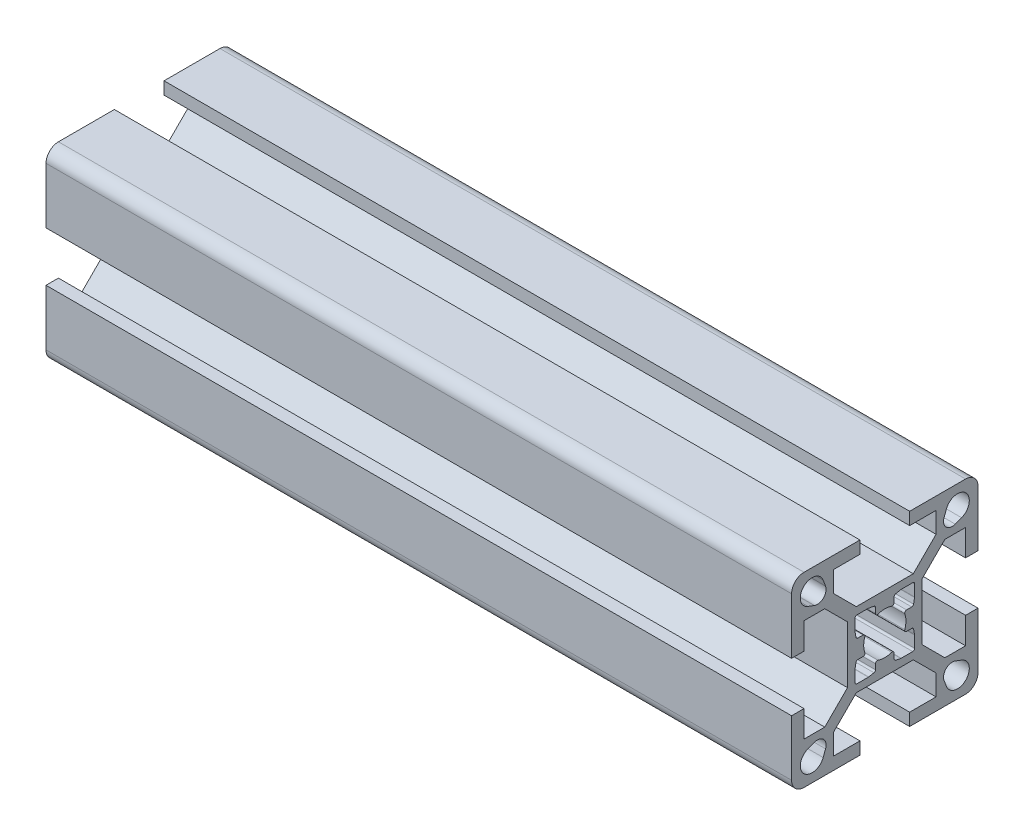
from build123d import *

# Parameters (mm, degrees)
BOSS_EXTRUDE1_DEPTH = 120


with BuildPart() as part:
    # Sketch1 → Boss-Extrude1 (new body)
    with BuildSketch(Plane(origin=(0, 0, 0), x_dir=(0, 0, -1), z_dir=(1, 0, 0))):
        with BuildLine():
            Line((-15, 13), (-15, 4))
            Line((-15, 4), (-13, 4))
            Line((-13, 4), (-13, 8.25))
            Line((-13, 8.25), (-9.664213562, 8.25))
            Line((-9.664213562, 8.25), (-6, 4.585786438))
            Line((-6, 4.585786438), (-6, -4.585786438))
            Line((-6, -4.585786438), (-9.664213562, -8.25))
            Line((-9.664213562, -8.25), (-13, -8.25))
            Line((-13, -8.25), (-13, -4))
            Line((-13, -4), (-15, -4))
            Line((-15, -4), (-15, -13))
            ThreePointArc((-15, -13), (-14.414213562, -14.414213562), (-13, -15))
            Line((-13, -15), (-4, -15))
            Line((-4, -15), (-4, -13))
            Line((-4, -13), (-8.25, -13))
            Line((-8.25, -13), (-8.25, -9.664213562))
            Line((-8.25, -9.664213562), (-4.585786438, -6))
            Line((-4.585786438, -6), (4.585786438, -6))
            Line((4.585786438, -6), (8.25, -9.664213562))
            Line((8.25, -9.664213562), (8.25, -13))
            Line((8.25, -13), (4, -13))
            Line((4, -13), (4, -15))
            Line((4, -15), (13, -15))
            ThreePointArc((13, -15), (14.414213562, -14.414213562), (15, -13))
            Line((15, -13), (15, -4))
            Line((15, -4), (13, -4))
            Line((13, -4), (13, -8.25))
            Line((13, -8.25), (9.664213562, -8.25))
            Line((9.664213562, -8.25), (6, -4.585786438))
            Line((6, -4.585786438), (6, 4.585786438))
            Line((6, 4.585786438), (9.664213562, 8.25))
            Line((9.664213562, 8.25), (13, 8.25))
            Line((13, 8.25), (13, 4))
            Line((13, 4), (15, 4))
            Line((15, 4), (15, 13))
            ThreePointArc((15, 13), (14.414213562, 14.414213562), (13, 15))
            Line((13, 15), (4, 15))
            Line((4, 15), (4, 13))
            Line((4, 13), (8.25, 13))
            Line((8.25, 13), (8.25, 9.664213562))
            Line((8.25, 9.664213562), (4.585786438, 6))
            Line((4.585786438, 6), (-4.585786438, 6))
            Line((-4.585786438, 6), (-8.25, 9.664213562))
            Line((-8.25, 9.664213562), (-8.25, 13))
            Line((-8.25, 13), (-4, 13))
            Line((-4, 13), (-4, 15))
            Line((-4, 15), (-13, 15))
            ThreePointArc((-13, 15), (-14.414213562, 14.414213562), (-15, 13))
        make_face()
        with BuildLine():
            Line((-9.539070071, 11.338915743), (-9.918883282, 12.361530981))
            ThreePointArc((-9.918883282, 12.361530981), (-13.043502884, 13.043502884), (-12.361530981, 9.918883282))
            Line((-12.361530981, 9.918883282), (-11.338915743, 9.539070071))
            ThreePointArc((-11.338915743, 9.539070071), (-9.861522369, 9.861522369), (-9.539070071, 11.338915743))
        make_face(mode=Mode.SUBTRACT)
        with BuildLine():
            Line((9.918883282, 12.361530981), (9.539070071, 11.338915743))
            ThreePointArc((9.539070071, 11.338915743), (9.861522369, 9.861522369), (11.338915743, 9.539070071))
            Line((11.338915743, 9.539070071), (12.361530981, 9.918883282))
            ThreePointArc((12.361530981, 9.918883282), (13.043502884, 13.043502884), (9.918883282, 12.361530981))
        make_face(mode=Mode.SUBTRACT)
        with BuildLine():
            Line((12.361530981, -9.918883282), (11.338915743, -9.539070071))
            ThreePointArc((11.338915743, -9.539070071), (9.861522369, -9.861522369), (9.539070071, -11.338915743))
            Line((9.539070071, -11.338915743), (9.918883282, -12.361530981))
            ThreePointArc((9.918883282, -12.361530981), (13.043502884, -13.043502884), (12.361530981, -9.918883282))
        make_face(mode=Mode.SUBTRACT)
        with BuildLine():
            Line((-11.338915743, -9.539070071), (-12.361530981, -9.918883282))
            ThreePointArc((-12.361530981, -9.918883282), (-13.043502884, -13.043502884), (-9.918883282, -12.361530981))
            Line((-9.918883282, -12.361530981), (-9.539070071, -11.338915743))
            ThreePointArc((-9.539070071, -11.338915743), (-9.861522369, -9.861522369), (-11.338915743, -9.539070071))
        make_face(mode=Mode.SUBTRACT)
        with BuildLine():
            Line((-4.8, -2.644433572), (-4.8, -4.5))
            ThreePointArc((-4.8, -4.5), (-4.712132034, -4.712132034), (-4.5, -4.8))
            Line((-4.5, -4.8), (-2.644433572, -4.8))
            ThreePointArc((-2.644433572, -4.8), (-2.615679847, -4.79861886), (-2.587190874, -4.794488155))
            Line((-2.587190874, -4.794488155), (-1.742757301, -4.630346896))
            ThreePointArc((-1.742757301, -4.630346896), (-1.568512625, -4.526682207), (-1.5, -4.335858741))
            Line((-1.5, -4.335858741), (-1.5, -3.5))
            ThreePointArc((-1.5, -3.5), (-1.374371458, -3.255879959), (-1.102702703, -3.216216216))
            ThreePointArc((-1.102702703, -3.216216216), (0, -3.4), (1.102702703, -3.216216216))
            ThreePointArc((1.102702703, -3.216216216), (1.374371458, -3.255879959), (1.5, -3.5))
            Line((1.5, -3.5), (1.5, -4.335858741))
            ThreePointArc((1.5, -4.335858741), (1.568512625, -4.526682207), (1.742757301, -4.630346896))
            Line((1.742757301, -4.630346896), (2.587190874, -4.794488155))
            ThreePointArc((2.587190874, -4.794488155), (2.615679847, -4.79861886), (2.644433572, -4.8))
            Line((2.644433572, -4.8), (4.5, -4.8))
            ThreePointArc((4.5, -4.8), (4.712132034, -4.712132034), (4.8, -4.5))
            Line((4.8, -4.5), (4.8, -2.644433572))
            ThreePointArc((4.8, -2.644433572), (4.79861886, -2.615679847), (4.794488155, -2.587190874))
            Line((4.794488155, -2.587190874), (4.630346896, -1.742757301))
            ThreePointArc((4.630346896, -1.742757301), (4.526682207, -1.568512625), (4.335858741, -1.5))
            Line((4.335858741, -1.5), (3.5, -1.5))
            ThreePointArc((3.5, -1.5), (3.255879959, -1.374371458), (3.216216216, -1.102702703))
            ThreePointArc((3.216216216, -1.102702703), (3.4, 0), (3.216216216, 1.102702703))
            ThreePointArc((3.216216216, 1.102702703), (3.255879959, 1.374371458), (3.5, 1.5))
            Line((3.5, 1.5), (4.335858741, 1.5))
            ThreePointArc((4.335858741, 1.5), (4.526682207, 1.568512625), (4.630346896, 1.742757301))
            Line((4.630346896, 1.742757301), (4.794488155, 2.587190874))
            ThreePointArc((4.794488155, 2.587190874), (4.79861886, 2.615679847), (4.8, 2.644433572))
            Line((4.8, 2.644433572), (4.8, 4.5))
            ThreePointArc((4.8, 4.5), (4.712132034, 4.712132034), (4.5, 4.8))
            Line((4.5, 4.8), (2.644433572, 4.8))
            ThreePointArc((2.644433572, 4.8), (2.615679847, 4.79861886), (2.587190874, 4.794488155))
            Line((2.587190874, 4.794488155), (1.742757301, 4.630346896))
            ThreePointArc((1.742757301, 4.630346896), (1.568512625, 4.526682207), (1.5, 4.335858741))
            Line((1.5, 4.335858741), (1.5, 3.5))
            ThreePointArc((1.5, 3.5), (1.374371458, 3.255879959), (1.102702703, 3.216216216))
            ThreePointArc((1.102702703, 3.216216216), (0, 3.4), (-1.102702703, 3.216216216))
            ThreePointArc((-1.102702703, 3.216216216), (-1.374371458, 3.255879959), (-1.5, 3.5))
            Line((-1.5, 3.5), (-1.5, 4.335858741))
            ThreePointArc((-1.5, 4.335858741), (-1.568512625, 4.526682207), (-1.742757301, 4.630346896))
            Line((-1.742757301, 4.630346896), (-2.587190874, 4.794488155))
            ThreePointArc((-2.587190874, 4.794488155), (-2.615679847, 4.79861886), (-2.644433572, 4.8))
            Line((-2.644433572, 4.8), (-4.5, 4.8))
            ThreePointArc((-4.5, 4.8), (-4.712132034, 4.712132034), (-4.8, 4.5))
            Line((-4.8, 4.5), (-4.8, 2.644433572))
            ThreePointArc((-4.8, 2.644433572), (-4.79861886, 2.615679847), (-4.794488155, 2.587190874))
            Line((-4.794488155, 2.587190874), (-4.630346896, 1.742757301))
            ThreePointArc((-4.630346896, 1.742757301), (-4.526682207, 1.568512625), (-4.335858741, 1.5))
            Line((-4.335858741, 1.5), (-3.5, 1.5))
            ThreePointArc((-3.5, 1.5), (-3.255879959, 1.374371458), (-3.216216216, 1.102702703))
            ThreePointArc((-3.216216216, 1.102702703), (-3.4, 0), (-3.216216216, -1.102702703))
            ThreePointArc((-3.216216216, -1.102702703), (-3.255879959, -1.374371458), (-3.5, -1.5))
            Line((-3.5, -1.5), (-4.335858741, -1.5))
            ThreePointArc((-4.335858741, -1.5), (-4.526682207, -1.568512625), (-4.630346896, -1.742757301))
            Line((-4.630346896, -1.742757301), (-4.794488155, -2.587190874))
            ThreePointArc((-4.794488155, -2.587190874), (-4.79861886, -2.615679847), (-4.8, -2.644433572))
        make_face(mode=Mode.SUBTRACT)
    extrude(amount=BOSS_EXTRUDE1_DEPTH)


solid = part.part
